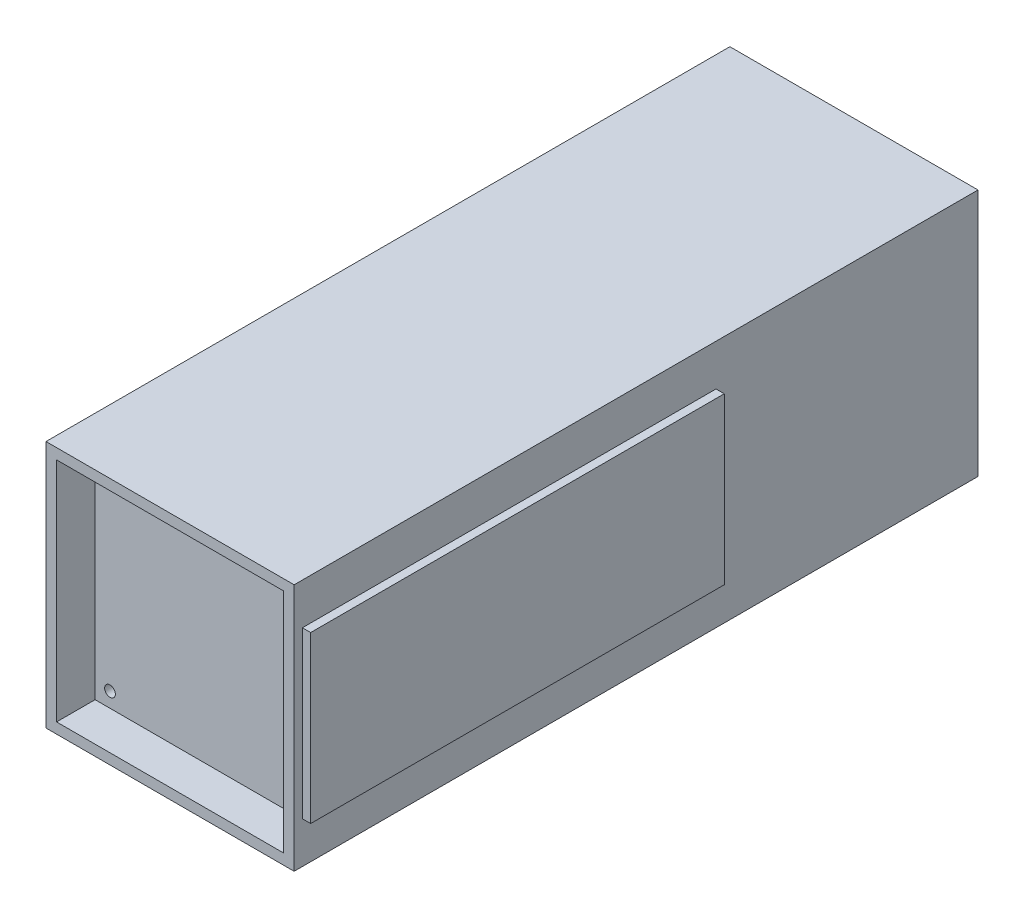
from build123d import *

# Parameters (mm, degrees)
SKETCH1_W                      = 76.2
SKETCH1_H                      = 76.2
SKETCH1_W_2                    = 69.6976
SKETCH1_H_2                    = 69.6976
BOSS_EXTRUDE1_DEPTH            = 210
BOSS_EXTRUDE2_START            = -10
SKETCH2_W                      = 66.04
SKETCH2_H                      = 66.04
BOSS_EXTRUDE2_DEPTH            = 3.048
SKETCH3_W                      = 127
SKETCH3_H                      = 50.8
BOSS_EXTRUDE3_DEPTH            = 2.54
SKETCH4_W                      = 69.6976
SKETCH4_H                      = 69.6976
BOSS_EXTRUDE4_DEPTH            = 1.27
SKETCH5_R                      = 1.524
CUT_EXTRUDE1_DEPTH             = 3.048
SKETCH6_R                      = 2.9972
SKETCH6_R_2                    = 2.159
BOSS_EXTRUDE5_DEPTH            = 10.16
BOSS_EXTRUDE5_2_DEPTH          = 10.16
BOSS_EXTRUDE5_3_DEPTH          = 10.16
BOSS_EXTRUDE5_4_DEPTH          = 10.16
BOSS_EXTRUDE6_START            = 10.16
SKETCH8_W                      = 66.04
SKETCH8_H                      = 66.04
SKETCH8_R                      = 2.159
BOSS_EXTRUDE6_DEPTH            = 3.048
M4X0_7_TAPPED_HOLE1_AT_2_COUNT = 2
M4X0_7_TAPPED_HOLE1_AT_2_PITCH = 56.896
M4X0_7_TAPPED_HOLE1_AT_3_COUNT = 2
M4X0_7_TAPPED_HOLE1_AT_3_PITCH = 80.463094845
M4X0_7_TAPPED_HOLE1_AT_4_COUNT = 2
M4X0_7_TAPPED_HOLE1_AT_4_PITCH = 56.896


with BuildPart() as part:
    # Sketch1 → Boss-Extrude1 (new body)
    with BuildSketch(Plane.XY):
        with Locations((38.1, 38.1)):
            Rectangle(SKETCH1_W, SKETCH1_H)
        with Locations((38.1, 38.1)):
            Rectangle(SKETCH1_W_2, SKETCH1_H_2, mode=Mode.SUBTRACT)
    extrude(amount=BOSS_EXTRUDE1_DEPTH)


with BuildPart() as body_2:
    # Sketch2 → Boss-Extrude2 (new body)
    with BuildSketch(Plane.XY.offset(210).offset(BOSS_EXTRUDE2_START)):
        with Locations((38.1, 38.1)):
            Rectangle(SKETCH2_W, SKETCH2_H)
    extrude(amount=-BOSS_EXTRUDE2_DEPTH)

    # Sketch5 → Cut-Extrude1 (cut)
    with BuildSketch(Plane.XY.offset(200)):
        with Locations((66.548, 9.652)):
            Circle(SKETCH5_R)
        with Locations((66.548, 66.548)):
            Circle(SKETCH5_R)
        with Locations((9.652, 66.548)):
            Circle(SKETCH5_R)
        with Locations((9.652, 9.652)):
            Circle(SKETCH5_R)
    extrude(amount=-CUT_EXTRUDE1_DEPTH, mode=Mode.SUBTRACT)


with BuildPart() as body_3:
    # Sketch3 → Boss-Extrude3 (new body)
    with BuildSketch(Plane(origin=(76.2, 0, 0), x_dir=(0, 0, -1), z_dir=(1, 0, 0))):
        with Locations((-143.96, 38.1)):
            Rectangle(SKETCH3_W, SKETCH3_H)
    extrude(amount=BOSS_EXTRUDE3_DEPTH)


with BuildPart() as body_4:
    # Sketch4 → Boss-Extrude4 (new body)
    with BuildSketch(Plane(origin=(0, 0, 196.952), x_dir=(-1, 0, 0), z_dir=(0, 0, -1))):
        with Locations((-38.1, 38.1)):
            Rectangle(SKETCH4_W, SKETCH4_H)
    extrude(amount=BOSS_EXTRUDE4_DEPTH)


with BuildPart() as body_5:
    # Mirror2: mirrored copy
    add(body_2.part.mirror(Plane.XY.offset(196.317)))


with BuildPart() as body_6:
    # Sketch6 → Boss-Extrude5 (new body)
    with BuildSketch(Plane(origin=(0, 0, 192.634), x_dir=(-1, 0, 0), z_dir=(0, 0, -1))):
        with Locations((-66.548, 9.652)):
            Circle(SKETCH6_R)
        with Locations((-66.548, 9.652)):
            Circle(SKETCH6_R_2, mode=Mode.SUBTRACT)
    extrude(amount=BOSS_EXTRUDE5_DEPTH)


with BuildPart() as body_7:
    # Sketch6 → Boss-Extrude5 2 (new body)
    with BuildSketch(Plane(origin=(0, 0, 192.634), x_dir=(-1, 0, 0), z_dir=(0, 0, -1))):
        with Locations((-66.548, 66.548)):
            Circle(SKETCH6_R)
        with Locations((-66.548, 66.548)):
            Circle(SKETCH6_R_2, mode=Mode.SUBTRACT)
    extrude(amount=BOSS_EXTRUDE5_2_DEPTH)


with BuildPart() as body_8:
    # Sketch6 → Boss-Extrude5 3 (new body)
    with BuildSketch(Plane(origin=(0, 0, 192.634), x_dir=(-1, 0, 0), z_dir=(0, 0, -1))):
        with Locations((-9.652, 66.548)):
            Circle(SKETCH6_R)
        with Locations((-9.652, 66.548)):
            Circle(SKETCH6_R_2, mode=Mode.SUBTRACT)
    extrude(amount=BOSS_EXTRUDE5_3_DEPTH)


with BuildPart() as body_9:
    # Sketch6 → Boss-Extrude5 4 (new body)
    with BuildSketch(Plane(origin=(0, 0, 192.634), x_dir=(-1, 0, 0), z_dir=(0, 0, -1))):
        with Locations((-9.652, 9.652)):
            Circle(SKETCH6_R)
        with Locations((-9.652, 9.652)):
            Circle(SKETCH6_R_2, mode=Mode.SUBTRACT)
    extrude(amount=BOSS_EXTRUDE5_4_DEPTH)


with BuildPart() as body_10:
    # Sketch8 → Boss-Extrude6 (new body)
    with BuildSketch(Plane(origin=(0, 0, 192.634), x_dir=(-1, 0, 0), z_dir=(0, 0, -1)).offset(BOSS_EXTRUDE6_START)):
        with Locations((-38.1, 38.1)):
            Rectangle(SKETCH8_W, SKETCH8_H)
        with Locations(Location((-9.652, 9.652, 0), (0, 0, 180))):
            Circle(SKETCH8_R, mode=Mode.SUBTRACT)
        with Locations(Location((-66.548, 9.652, 0), (0, 0, 180))):
            Circle(SKETCH8_R, mode=Mode.SUBTRACT)
        with Locations(Location((-66.548, 66.548, 0), (0, 0, 180))):
            Circle(SKETCH8_R, mode=Mode.SUBTRACT)
        with Locations(Location((-9.652, 66.548, 0), (0, 0, 180))):
            Circle(SKETCH8_R, mode=Mode.SUBTRACT)
    extrude(amount=BOSS_EXTRUDE6_DEPTH)


with BuildPart() as body_2_1:
    add(body_2.part)

    # Sketch13 → M4x0.7 Tapped Hole1 (revolve, cut)
    with BuildSketch(Plane(origin=(9.652, 66.548, 200), x_dir=(0, -1, 0), z_dir=(1, 0, 0))):
        Polygon((0, 0), (0, 4.038420021), (1.65, 3.047), (1.65, 0), align=None)
    m4x0_7_tapped_hole1 = revolve(axis=Axis((9.652, 66.548, 206.35), (0, 0, -1)), mode=Mode.SUBTRACT)

    # M4x0.7 Tapped Hole1 at 2: M4x0.7 Tapped Hole1 ×2
    with Locations(*[(i * M4X0_7_TAPPED_HOLE1_AT_2_PITCH, 0, 0) for i in range(1, M4X0_7_TAPPED_HOLE1_AT_2_COUNT)]):
        add(m4x0_7_tapped_hole1, mode=Mode.SUBTRACT)

    # M4x0.7 Tapped Hole1 at 3: M4x0.7 Tapped Hole1 ×2
    with Locations(*[Vector(0.7071067811865502, -0.7071067811865449, 0) * (i * M4X0_7_TAPPED_HOLE1_AT_3_PITCH) for i in range(1, M4X0_7_TAPPED_HOLE1_AT_3_COUNT)]):
        add(m4x0_7_tapped_hole1, mode=Mode.SUBTRACT)

    # M4x0.7 Tapped Hole1 at 4: M4x0.7 Tapped Hole1 ×2
    with Locations(*[(0, -i * M4X0_7_TAPPED_HOLE1_AT_4_PITCH, 0) for i in range(1, M4X0_7_TAPPED_HOLE1_AT_4_COUNT)]):
        add(m4x0_7_tapped_hole1, mode=Mode.SUBTRACT)


solid = Compound([part.part, body_3.part, body_4.part, body_5.part, body_6.part, body_7.part, body_8.part, body_9.part, body_10.part, body_2_1.part])
